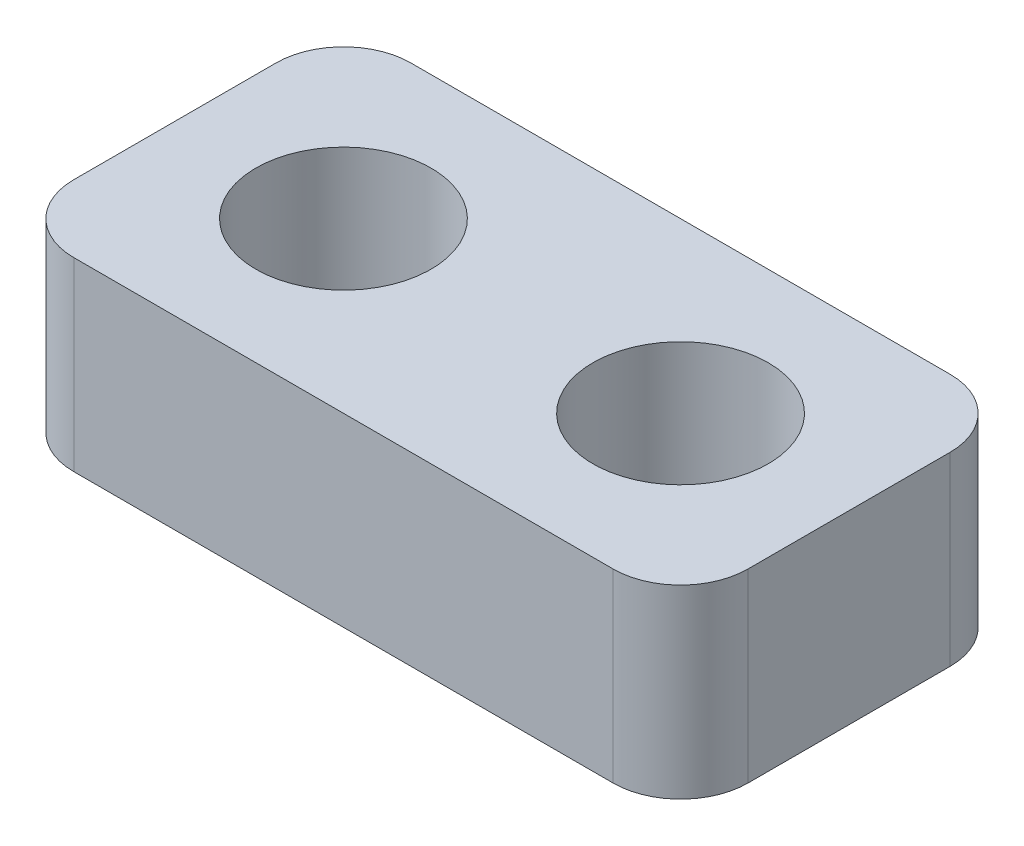
from build123d import *

# Parameters (mm, degrees)
SKETCH1_W           = 20
SKETCH1_H           = 10
SKETCH1_R           = 2.6
BOSS_EXTRUDE1_DEPTH = 5.5
FILLET1_R           = 2


with BuildPart() as part:
    # Sketch1 → Boss-Extrude1 (new body)
    with BuildSketch(Plane(origin=(0, 0, 0), x_dir=(1, 0, 0), z_dir=(0, 1, 0))):
        with Locations((10, 5)):
            Rectangle(SKETCH1_W, SKETCH1_H)
        with Locations(Location((5, 5, 0), (0, 0, 270))):
            Circle(SKETCH1_R, mode=Mode.SUBTRACT)
        with Locations(Location((15, 5, 0), (0, 0, 90))):
            Circle(SKETCH1_R, mode=Mode.SUBTRACT)
    extrude(amount=BOSS_EXTRUDE1_DEPTH)

    # Fillet1
    fillet1_edges = [part.edges().sort_by_distance(p)[0] for p in [
        (0, 2.75, -10),
        (20, 2.75, -10),
        (20, 2.75, 0),
        (0, 2.75, 0),
    ]]
    fillet(fillet1_edges, radius=FILLET1_R)


solid = part.part
